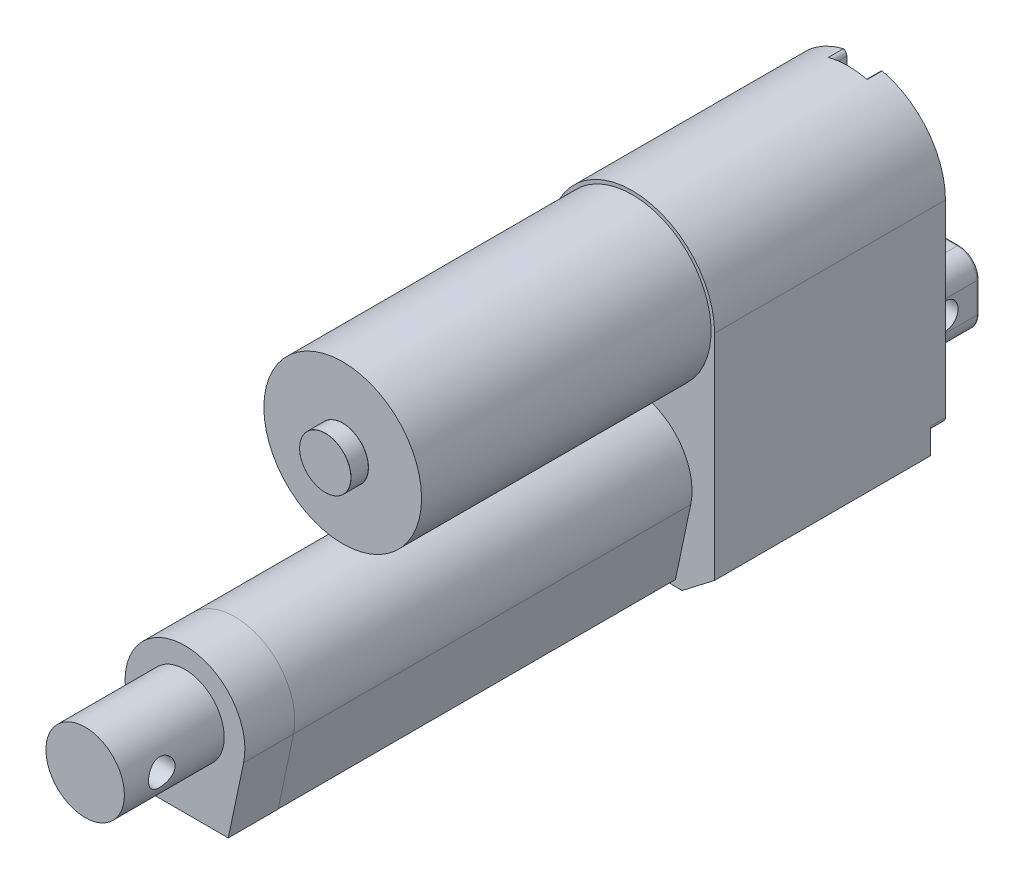
from build123d import *

# Parameters (mm, degrees)
BOSS_EXTRUDE1_DEPTH                      = 58.7375
SKETCH2_R                                = 20.066
BOSS_EXTRUDE2_DEPTH                      = 73.66
EDIT_LENGTH_HERE_HOVER_FOR_COMMENT_DEPTH = 113.792
SKETCH4_R                                = 9.9822
BOSS_EXTRUDE4_DEPTH                      = 25.4
BOSS_EXTRUDE5_DEPTH                      = 20.6502
CUT_EXTRUDE3_DEPTH                       = 217.231560923
CUT_EXTRUDE3_DEPTH_BACK                  = 217.231560923
SKETCH6_R                                = 3.3782
FILLET1_R                                = 2.54
FILLET2_R                                = 0.508
CUT_EXTRUDE5_DEPTH                       = 3.81
SKETCH8_R                                = 6.5405
BOSS_EXTRUDE6_DEPTH                      = 4.445
FILLET3_R                                = 0.0254
BOSS_EXTRUDE7_START                      = -12.7
BOSS_EXTRUDE7_DEPTH                      = 12.7
SKETCH10_R                               = 2.54
BOSS_EXTRUDE8_DEPTH                      = 0.635


with BuildPart() as part:
    # Sketch1 → Boss-Extrude1 (new body)
    with BuildSketch(Plane.XY):
        with BuildLine():
            Line((-12.7, 0), (12.7, 0))
            Line((12.7, 0), (20.955, 6.35))
            Line((20.955, 6.35), (20.955, 60.833))
            ThreePointArc((20.955, 60.833), (0, 81.788), (-20.955, 60.833))
            Line((-20.955, 60.833), (-20.955, 6.35))
            Line((-20.955, 6.35), (-12.7, 0))
        make_face()
    extrude(amount=BOSS_EXTRUDE1_DEPTH)

    # Sketch2 → Boss-Extrude2 (add)
    with BuildSketch(Plane.XY.offset(58.7375)):
        with Locations(Location((0, 60.833, 0), (0, 0, 180))):
            Circle(SKETCH2_R)
    extrude(amount=BOSS_EXTRUDE2_DEPTH)

    # Sketch3 → EDIT_LENGTH_HERE (hover for comment) (add)
    with BuildSketch(Plane.XY.offset(58.7375)):
        with BuildLine():
            Line((-14.88814822, 20.042680112), (-10.996912775, 1.5621))
            Line((-10.996912775, 1.5621), (10.996912775, 1.5621))
            Line((10.996912775, 1.5621), (14.88814822, 20.042680112))
            ThreePointArc((14.88814822, 20.042680112), (0, 38.3921), (-14.88814822, 20.042680112))
        make_face()
    extrude(amount=EDIT_LENGTH_HERE_HOVER_FOR_COMMENT_DEPTH)

    # Sketch4 → Boss-Extrude4 (add)
    with BuildSketch(Plane.XY.offset(172.5295)):
        with Locations((0, 23.1775)):
            Circle(SKETCH4_R)
    extrude(amount=BOSS_EXTRUDE4_DEPTH)

    # Sketch5 → Boss-Extrude5 (add)
    with BuildSketch(Plane(origin=(0, 0, 0), x_dir=(-1, 0, 0), z_dir=(0, 0, -1))):
        with BuildLine():
            Line((-3.81, 32.0675), (3.81, 32.0675))
            ThreePointArc((3.81, 32.0675), (7.402102448, 30.579602448), (8.89, 26.9875))
            Line((8.89, 26.9875), (8.89, 19.3675))
            ThreePointArc((8.89, 19.3675), (7.402102448, 15.775397552), (3.81, 14.2875))
            Line((3.81, 14.2875), (-3.81, 14.2875))
            ThreePointArc((-3.81, 14.2875), (-7.402102448, 15.775397552), (-8.89, 19.3675))
            Line((-8.89, 19.3675), (-8.89, 26.9875))
            ThreePointArc((-8.89, 26.9875), (-7.402102448, 30.579602448), (-3.81, 32.0675))
        make_face()
    extrude(amount=BOSS_EXTRUDE5_DEPTH)

    # Sketch6 → Cut-Extrude3 (cut, two sides: drawn at the far end of the back side and taken through both)
    with BuildSketch(Plane(origin=(8.89, 0, 0), x_dir=(0, 0, -1), z_dir=(1, 0, 0)).offset(-CUT_EXTRUDE3_DEPTH_BACK)):
        with Locations((11.90625, 23.1775)):
            Circle(SKETCH6_R)
        with Locations(Location((-188.4045, 23.1775, 0), (0, 0, 179.999999986))):
            Circle(SKETCH6_R)
    extrude(amount=CUT_EXTRUDE3_DEPTH + CUT_EXTRUDE3_DEPTH_BACK, mode=Mode.SUBTRACT)

    # Fillet1
    fillet1_edges = [part.edges().sort_by_distance(p)[0] for p in [
        (7.402102448, 15.775397552, 0),
        (0, 14.2875, 0),
        (-7.402102448, 15.775397552, 0),
        (-8.89, 23.1775, 0),
        (-7.402102448, 30.579602448, 0),
        (0, 32.0675, 0),
        (7.402102448, 30.579602448, 0),
        (8.89, 23.1775, 0),
    ]]
    fillet(fillet1_edges, radius=FILLET1_R)

    # Fillet2
    fillet2_edges = [part.edges().sort_by_distance(p)[0] for p in [
        (7.402102448, 15.775397552, -20.6502),
        (0, 14.2875, -20.6502),
        (-7.402102448, 15.775397552, -20.6502),
        (-8.89, 23.1775, -20.6502),
        (-7.402102448, 30.579602448, -20.6502),
        (0, 32.0675, -20.6502),
        (7.402102448, 30.579602448, -20.6502),
        (8.89, 23.1775, -20.6502),
    ]]
    fillet(fillet2_edges, radius=FILLET2_R)

    # Sketch7 → Cut-Extrude5 (cut)
    with BuildSketch(Plane(origin=(0, 0, 0), x_dir=(-1, 0, 0), z_dir=(0, 0, -1))):
        with BuildLine():
            Line((-4.1275, 80.068311519), (-4.1275, 77.089))
            ThreePointArc((-4.1275, 77.089), (0, 72.9615), (4.1275, 77.089))
            Line((4.1275, 77.089), (4.1275, 79.978628931))
            ThreePointArc((4.1275, 79.978628931), (4.367379625, 80.721429048), (4.996400809, 81.183626623))
            ThreePointArc((4.996400809, 81.183626623), (0.071861599, 81.787876781), (-4.856706104, 81.217416372))
            ThreePointArc((-4.856706104, 81.217416372), (-4.325187488, 80.748786262), (-4.1275, 80.068311519))
        make_face()
        with BuildLine():
            ThreePointArc((-19.685, 11.610879552), (-20.583025612, 11.98285394), (-20.955, 12.880879552))
            Line((-20.955, 12.880879552), (-20.955, 6.35))
            Line((-20.955, 6.35), (-13.042377801, 0.26336754))
            ThreePointArc((-13.042377801, 0.26336754), (-13.507857108, 0.994743297), (-13.395607029, 1.854383572))
            Line((-13.395607029, 1.854383572), (-11.222314297, 6.047728836))
            ThreePointArc((-11.222314297, 6.047728836), (-11.349573436, 9.780348644), (-14.605, 11.610879552))
            Line((-14.605, 11.610879552), (-19.685, 11.610879552))
        make_face()
        with BuildLine():
            Line((20.955, 6.35), (20.955, 12.880879552))
            ThreePointArc((20.955, 12.880879552), (20.583025612, 11.98285394), (19.685, 11.610879552))
            Line((19.685, 11.610879552), (14.605, 11.610879552))
            ThreePointArc((14.605, 11.610879552), (11.203032914, 9.51631534), (11.541558483, 5.535614431))
            Line((11.541558483, 5.535614431), (13.402295436, 1.841293477))
            ThreePointArc((13.402295436, 1.841293477), (13.506243345, 0.987572709), (13.042377827, 0.263367559))
            Line((13.042377827, 0.263367559), (20.955, 6.35))
        make_face()
    extrude(amount=-CUT_EXTRUDE5_DEPTH, mode=Mode.SUBTRACT)

    # Sketch8 → Boss-Extrude6 (add)
    with BuildSketch(Plane.XY.offset(132.3975)):
        with Locations((0, 60.833)):
            Circle(SKETCH8_R)
    extrude(amount=BOSS_EXTRUDE6_DEPTH)

    # Fillet3
    fillet3_edges = [part.edges().sort_by_distance(p)[0] for p in [
        (-6.5405, 60.833, 132.3975),
        (-6.5405, 60.833, 136.8425),
    ]]
    fillet(fillet3_edges, radius=FILLET3_R)

    # Sketch9 → Boss-Extrude7 (add)
    with BuildSketch(Plane.XY.offset(172.5295).offset(BOSS_EXTRUDE7_START)):
        with BuildLine():
            Line((-11.017521545, 1.5367), (11.017521545, 1.5367))
            Line((11.017521545, 1.5367), (14.913003226, 20.03744669))
            ThreePointArc((14.913003226, 20.03744669), (0, 38.4175), (-14.913003226, 20.03744669))
            Line((-14.913003226, 20.03744669), (-11.017521545, 1.5367))
        make_face()
        with BuildLine():
            Line((10.996912775, 1.5621), (14.88814822, 20.042680112))
            ThreePointArc((14.88814822, 20.042680112), (0, 38.3921), (-14.88814822, 20.042680112))
            Line((-14.88814822, 20.042680112), (-10.996912775, 1.5621))
            Line((-10.996912775, 1.5621), (10.996912775, 1.5621))
        make_face(mode=Mode.SUBTRACT)
    extrude(amount=BOSS_EXTRUDE7_DEPTH)

    # Sketch10 → Boss-Extrude8 (add)
    with BuildSketch(Plane(origin=(0, 0, 3.81), x_dir=(-1, 0, 0), z_dir=(0, 0, -1))):
        with Locations((0, 77.089)):
            Circle(SKETCH10_R)
        with Locations((-14.605, 7.800879552)):
            Circle(SKETCH10_R)
        with Locations((14.605, 7.800879552)):
            Circle(SKETCH10_R)
    extrude(amount=BOSS_EXTRUDE8_DEPTH)


solid = part.part
